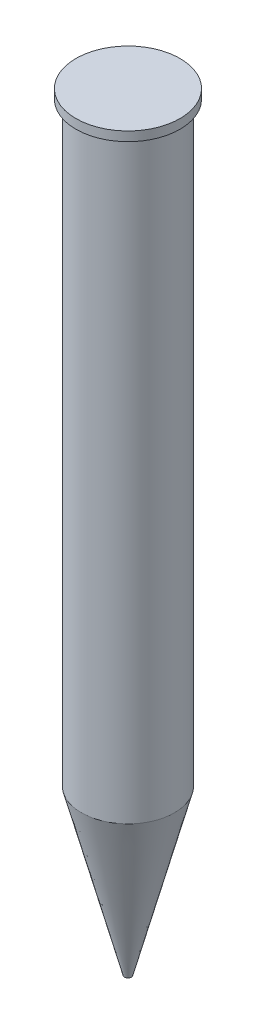
from build123d import *

# Parameters (mm, degrees)
SKETCH1_R           = 63.5
BOSS_EXTRUDE1_DEPTH = 812.8
SKETCH2_R           = 71.128555951
BOSS_EXTRUDE2_DEPTH = 12.7


with BuildPart() as part:
    # Sketch1 → Boss-Extrude1 (new body)
    with BuildSketch(Plane(origin=(0, 0, 0), x_dir=(1, 0, 0), z_dir=(0, 1, 0))):
        with Locations(Location((0, 0, 0), (0, 0, 270))):
            Circle(SKETCH1_R)
    extrude(amount=BOSS_EXTRUDE1_DEPTH)

    # Sketch2 → Boss-Extrude2 (add)
    with BuildSketch(Plane(origin=(0, 812.8, 0), x_dir=(1, 0, 0), z_dir=(0, 1, 0))):
        with Locations(Location((0, 0, 0), (0, 0, 270))):
            Circle(SKETCH2_R)
    extrude(amount=BOSS_EXTRUDE2_DEPTH)

    # Sketch5 → Revolve2 (revolve)
    with BuildSketch(Plane(origin=(0, 0, 0), x_dir=(0, 0, -1), z_dir=(1, 0, 0))):
        Polygon((-63.5, 0), (0, 0), (0, -223.940998137), (-4.689426477, -223.940998137), align=None)
    revolve(axis=Axis((0, 0, 0), (0, -1, 0)))


solid = part.part
